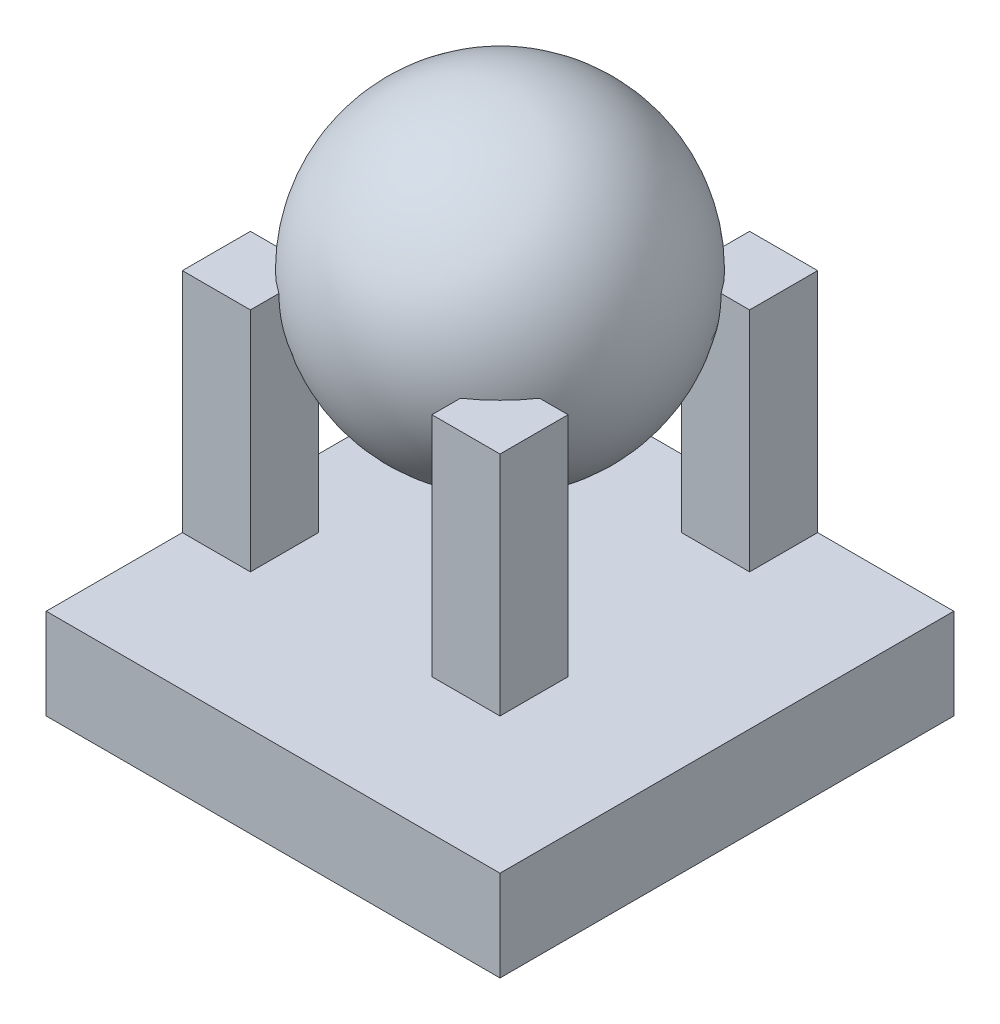
from build123d import *

# Parameters (mm, degrees)
CROQUIS1_W              = 100
CROQUIS1_H              = 100
SALIENTE_EXTRUIR1_DEPTH = 20
CROQUIS2_W              = 15
CROQUIS2_H              = 15
SALIENTE_EXTRUIR2_DEPTH = 50


with BuildPart() as part:
    # Croquis1 → Saliente-Extruir1 (new body)
    with BuildSketch(Plane(origin=(0, 0, 0), x_dir=(1, 0, 0), z_dir=(0, 1, 0))):
        Rectangle(CROQUIS1_W, CROQUIS1_H)
    extrude(amount=SALIENTE_EXTRUIR1_DEPTH)

    # Croquis2 → Saliente-Extruir2 (add)
    with BuildSketch(Plane(origin=(0, 20, 0), x_dir=(1, 0, 0), z_dir=(0, 1, 0))):
        with Locations((-42.5, -12.5)):
            Rectangle(CROQUIS2_W, CROQUIS2_H)
        with Locations((-42.5, 42.5)):
            Rectangle(CROQUIS2_W, CROQUIS2_H)
        with Locations((12.5, 42.5)):
            Rectangle(CROQUIS2_W, CROQUIS2_H)
        with Locations((12.5, -12.5)):
            Rectangle(CROQUIS2_W, CROQUIS2_H)
    extrude(amount=SALIENTE_EXTRUIR2_DEPTH)

    # Croquis4 → Revolución1 (revolve)
    with BuildSketch(Plane.XY.offset(-15)):
        with BuildLine():
            Line((-15, 105), (-15, 35))
            ThreePointArc((-15, 35), (-50, 70), (-15, 105))
        make_face()
    revolve(axis=Axis((-15, 105, -15), (0, -1, 0)))


solid = part.part
